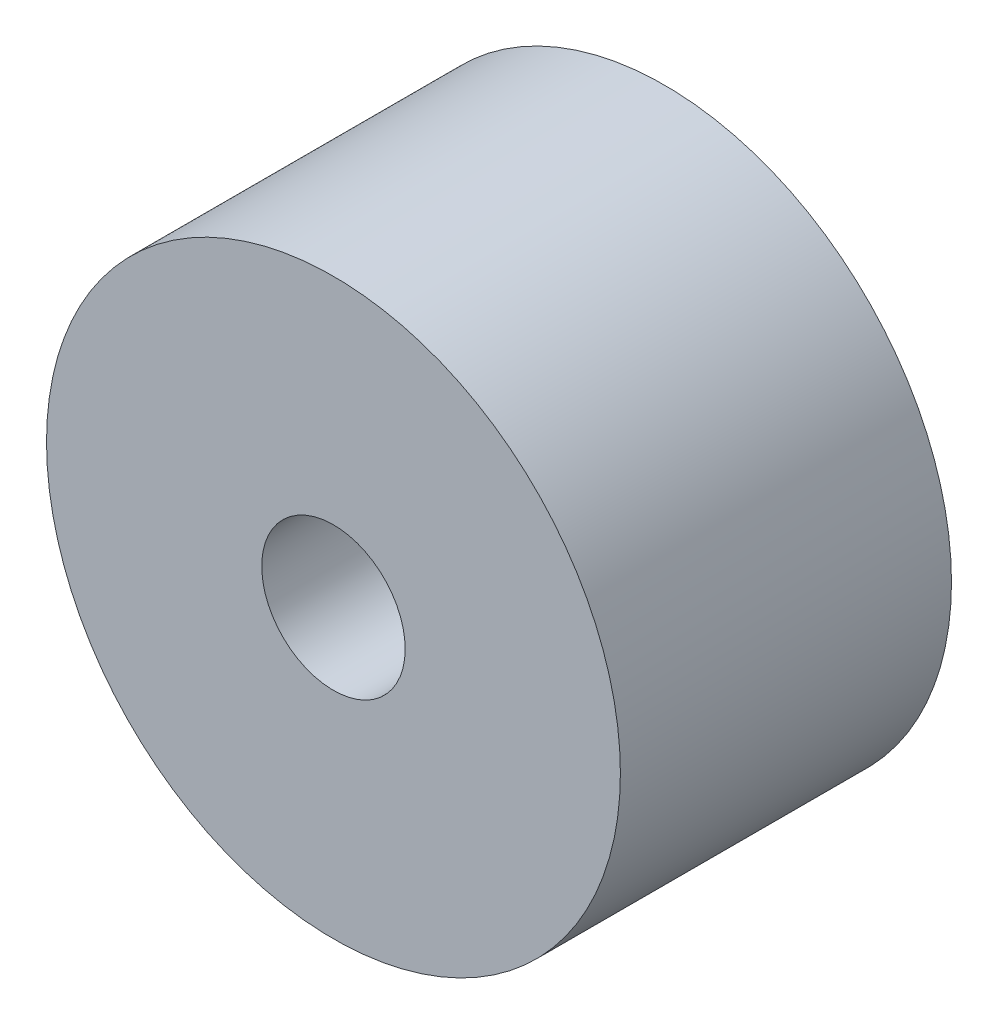
from build123d import *

# Parameters (mm, degrees)
S01_SWAGED_END_STOP_R      = 2.6
S01_SWAGED_END_STOP_R_2    = 0.65
F_01_SWAGED_END_STOP_DEPTH = 3


with BuildPart() as part:
    # S01 - Swaged end stop → 01 - Swaged end stop (new body)
    with BuildSketch(Plane.XY):
        Circle(S01_SWAGED_END_STOP_R)
        Circle(S01_SWAGED_END_STOP_R_2, mode=Mode.SUBTRACT)
    extrude(amount=F_01_SWAGED_END_STOP_DEPTH)


solid = part.part
